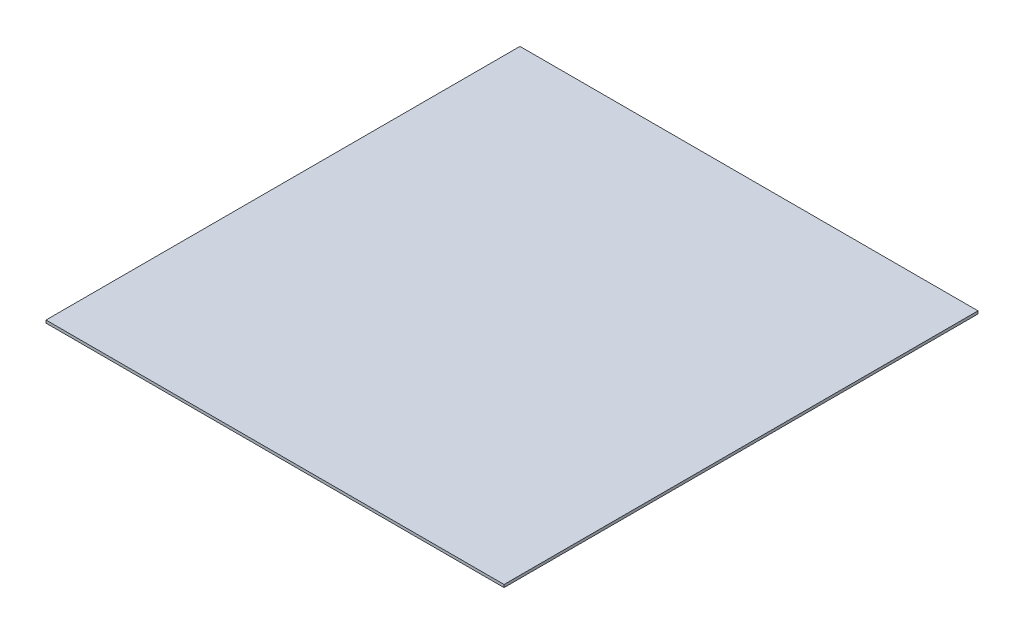
from build123d import *

# Parameters (mm, degrees)
SKETCH1_W           = 1500
SKETCH1_H           = 1552
BOSS_EXTRUDE1_DEPTH = 9


with BuildPart() as part:
    # Sketch1 → Boss-Extrude1 (new body)
    with BuildSketch(Plane(origin=(0, 0, 0), x_dir=(1, 0, 0), z_dir=(0, 1, 0))):
        with Locations((750, -776)):
            Rectangle(SKETCH1_W, SKETCH1_H)
    extrude(amount=BOSS_EXTRUDE1_DEPTH)


solid = part.part
